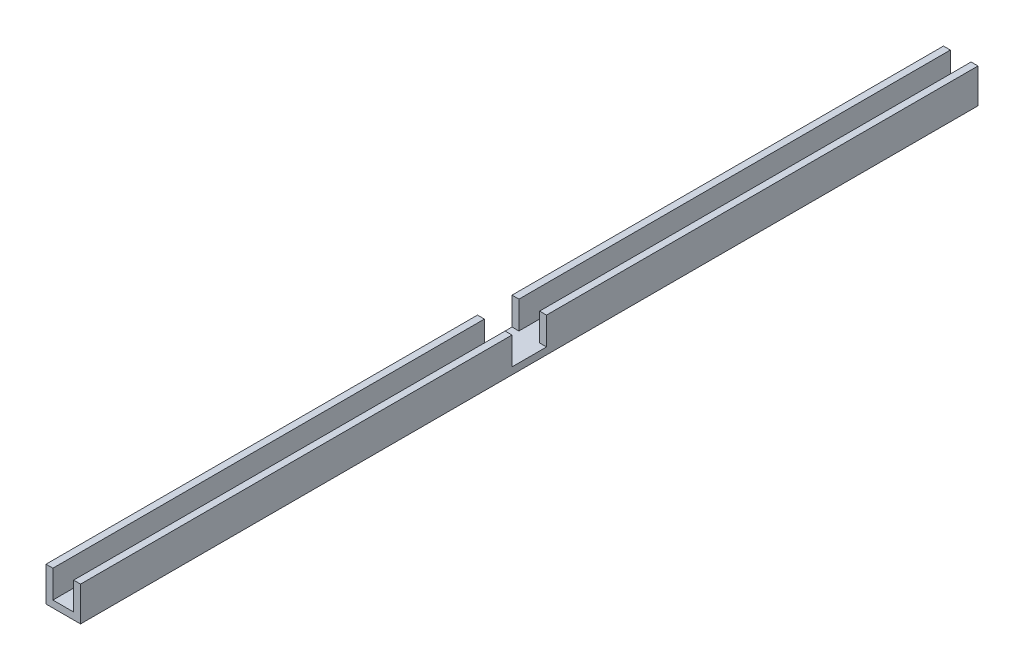
from build123d import *

# Parameters (mm, degrees)
BOSS_EXTRU_1_DEPTH      = 260
ENL_V_MAT_EXTRU_1_DEPTH = 8


with BuildPart() as part:
    # Esquisse1 → Boss.-Extru.1 (new body)
    with BuildSketch(Plane.XY):
        Polygon((0, 0), (0, -10), (10, -10), (10, 0), (8, 0), (8, -8), (2, -8), (2, 0), align=None)
    extrude(amount=BOSS_EXTRU_1_DEPTH)

    # Esquisse2 → Enlèv. mat.-Extru.1 (cut)
    with BuildSketch(Plane(origin=(0, 0, 0), x_dir=(1, 0, 0), z_dir=(0, 1, 0))):
        Polygon((-8.996226047, -125), (31.208128552, -125), (31.208128552, -127.984639705), (31.208128552, -135), (-8.996226047, -135), align=None)
    extrude(amount=-ENL_V_MAT_EXTRU_1_DEPTH, mode=Mode.SUBTRACT)


solid = part.part
